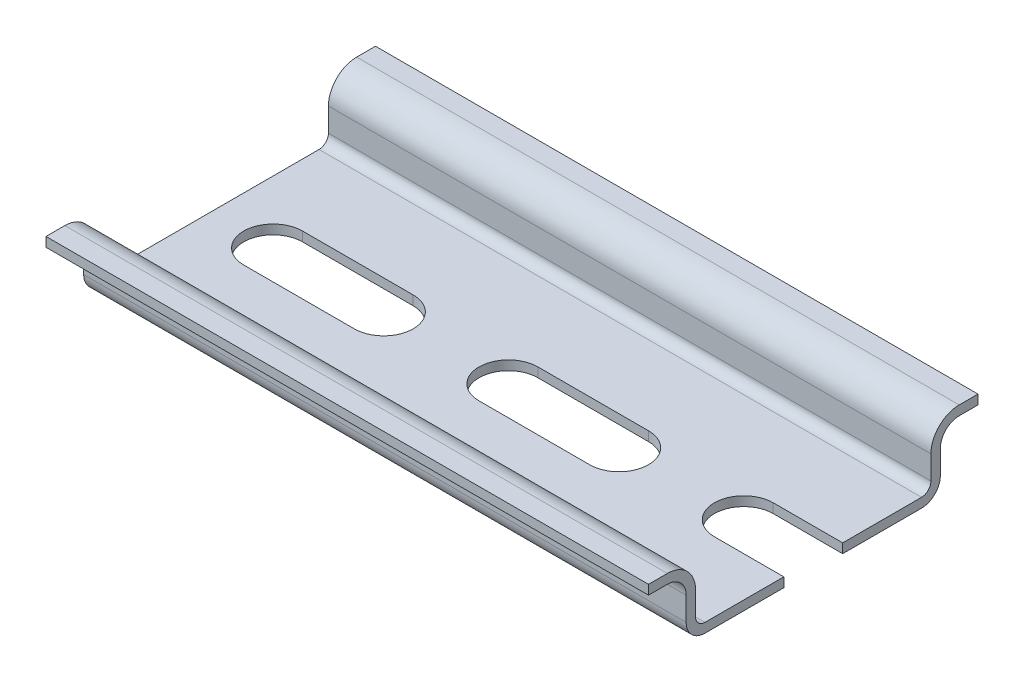
from build123d import *

# Parameters (mm, degrees)
EXTRUDE_THIN1_DEPTH             = 37.5
EXTRUDE_THIN1_DEPTH_BACK        = 37.5
CUT_EXTRUDE1_REACH              = 44.057
LPATTERN1_COUNT                 = 2
LPATTERN1_PITCH                 = 25
LPATTERN1_COL_COUNT             = 2
LPATTERN1_COL_PITCH             = 25
SCHNITT_LINEAR_START            = -11
SCHNITT_LINEAR_AUSTRAGEN1_DEPTH = 11


with BuildPart() as part:
    # Sketch1 → Extrude-Thin1 (new, two sides: drawn at the far end of the back side and taken through both)
    with BuildSketch(Plane(origin=(0, 0, 0), x_dir=(0, 0, -1), z_dir=(1, 0, 0)).offset(-EXTRUDE_THIN1_DEPTH_BACK)):
        with BuildLine():
            Line((-17.5, 6.5), (-15.5, 6.5))
            ThreePointArc((-15.5, 6.5), (-14.085786438, 5.914213562), (-13.5, 4.5))
            Line((-13.5, 4.5), (-13.5, 2))
            ThreePointArc((-13.5, 2), (-12.914213562, 0.585786438), (-11.5, 0))
            Line((-11.5, 0), (11.5, 0))
            ThreePointArc((11.5, 0), (12.914213562, 0.585786438), (13.5, 2))
            Line((13.5, 2), (13.5, 4.5))
            ThreePointArc((13.5, 4.5), (14.085786438, 5.914213562), (15.5, 6.5))
            Line((15.5, 6.5), (17.5, 6.5))
            Line((17.5, 6.5), (17.5, 7.5))
            Line((17.5, 7.5), (15.5, 7.5))
            ThreePointArc((15.5, 7.5), (13.378679656, 6.621320344), (12.5, 4.5))
            Line((12.5, 4.5), (12.5, 2))
            ThreePointArc((12.5, 2), (12.207106781, 1.292893219), (11.5, 1))
            Line((11.5, 1), (-11.5, 1))
            ThreePointArc((-11.5, 1), (-12.207106781, 1.292893219), (-12.5, 2))
            Line((-12.5, 2), (-12.5, 4.5))
            ThreePointArc((-12.5, 4.5), (-13.378679656, 6.621320344), (-15.5, 7.5))
            Line((-15.5, 7.5), (-17.5, 7.5))
            Line((-17.5, 7.5), (-17.5, 6.5))
        make_face()
    extrude(amount=EXTRUDE_THIN1_DEPTH + EXTRUDE_THIN1_DEPTH_BACK)

    # Sketch2 → Cut-Extrude1 (cut, up to next)
    with BuildSketch(Plane.XZ, mode=Mode.PRIVATE) as cut_extrude1_sk1:
        with BuildLine():
            Line((-5.875, 3.125), (5.875, 3.125))
            ThreePointArc((5.875, 3.125), (9, 0), (5.875, -3.125))
            Line((5.875, -3.125), (-5.875, -3.125))
            ThreePointArc((-5.875, -3.125), (-9, 0), (-5.875, 3.125))
        make_face()
    cut_extrude1_tool1 = extrude(cut_extrude1_sk1.sketch, amount=-CUT_EXTRUDE1_REACH, mode=Mode.PRIVATE) & part.part
    cut_extrude1 = cut_extrude1_tool1.solids().sort_by_distance((0, 0, 0))[0]
    add(cut_extrude1, mode=Mode.SUBTRACT)

    # LPattern1: Cut-Extrude1 ×2
    with Locations(*[(i * LPATTERN1_PITCH, 0, 0) for i in range(1, LPATTERN1_COUNT)]):
        add(cut_extrude1, mode=Mode.SUBTRACT)

    # LPattern1 col: Cut-Extrude1 ×2
    with Locations(*[(-i * LPATTERN1_COL_PITCH, 0, 0) for i in range(1, LPATTERN1_COL_COUNT)]):
        add(cut_extrude1, mode=Mode.SUBTRACT)

    # Skizze1 → Schnitt-Linear austragen1 (cut)
    with BuildSketch(Plane(origin=(37.5, 0, 0), x_dir=(0, 0, -1), z_dir=(1, 0, 0)).offset(SCHNITT_LINEAR_START)):
        with BuildLine():
            Line((-15.5, 7.5), (-17.5, 7.5))
            Line((-17.5, 7.5), (-17.5, 6.5))
            Line((-17.5, 6.5), (-15.5, 6.5))
            ThreePointArc((-15.5, 6.5), (-14.085786438, 5.914213562), (-13.5, 4.5))
            Line((-13.5, 4.5), (-13.5, 2))
            ThreePointArc((-13.5, 2), (-12.914213562, 0.585786438), (-11.5, 0))
            Line((-11.5, 0), (11.5, 0))
            ThreePointArc((11.5, 0), (12.914213562, 0.585786438), (13.5, 2))
            Line((13.5, 2), (13.5, 4.5))
            ThreePointArc((13.5, 4.5), (14.085786438, 5.914213562), (15.5, 6.5))
            Line((15.5, 6.5), (17.5, 6.5))
            Line((17.5, 6.5), (17.5, 7.5))
            Line((17.5, 7.5), (15.5, 7.5))
            ThreePointArc((15.5, 7.5), (13.378679656, 6.621320344), (12.5, 4.5))
            Line((12.5, 4.5), (12.5, 2))
            ThreePointArc((12.5, 2), (12.207106781, 1.292893219), (11.5, 1))
            Line((11.5, 1), (-11.5, 1))
            ThreePointArc((-11.5, 1), (-12.207106781, 1.292893219), (-12.5, 2))
            Line((-12.5, 2), (-12.5, 4.5))
            ThreePointArc((-12.5, 4.5), (-13.378679656, 6.621320344), (-15.5, 7.5))
        make_face()
    extrude(amount=SCHNITT_LINEAR_AUSTRAGEN1_DEPTH, mode=Mode.SUBTRACT)


solid = part.part
